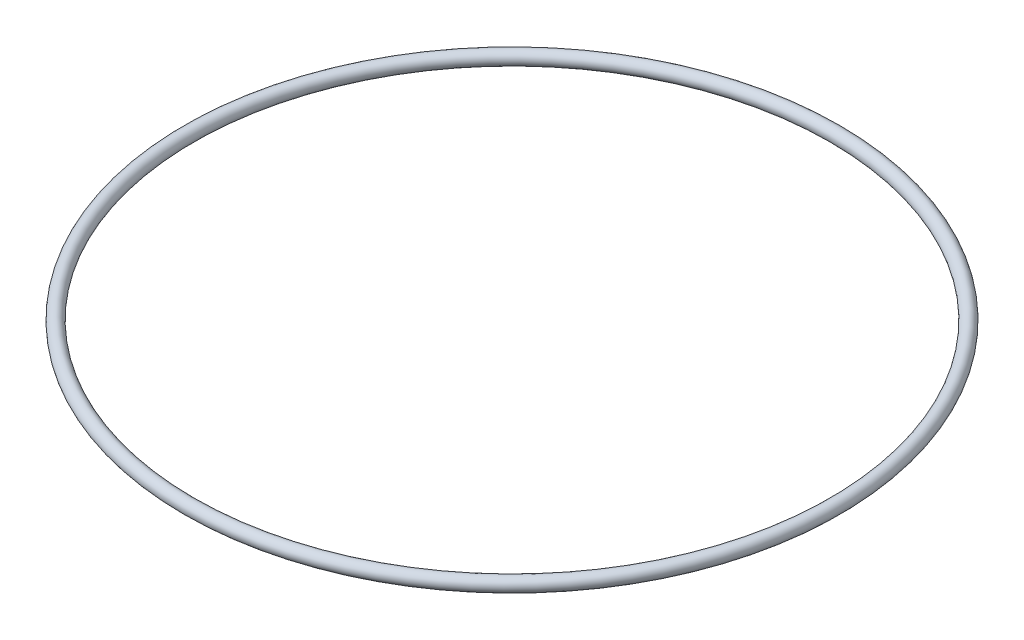
from build123d import *

# Parameters (mm, degrees)
SZKIC1_R   = 1.25
SZKIC1_R_2 = 0.645451577


with BuildPart() as part:
    # Szkic1 → Obrót1 (revolve)
    with BuildSketch(Plane.XY, mode=Mode.PRIVATE) as obr_t1_sk:
        Circle(SZKIC1_R)
        Circle(SZKIC1_R_2, mode=Mode.SUBTRACT)
    revolve(obr_t1_sk.sketch.rotate(Axis((59.5, -11.058029352, 0), (0, 1, 0)), 270), axis=Axis((59.5, -11.058029352, 0), (0, 1, 0)))


solid = part.part
